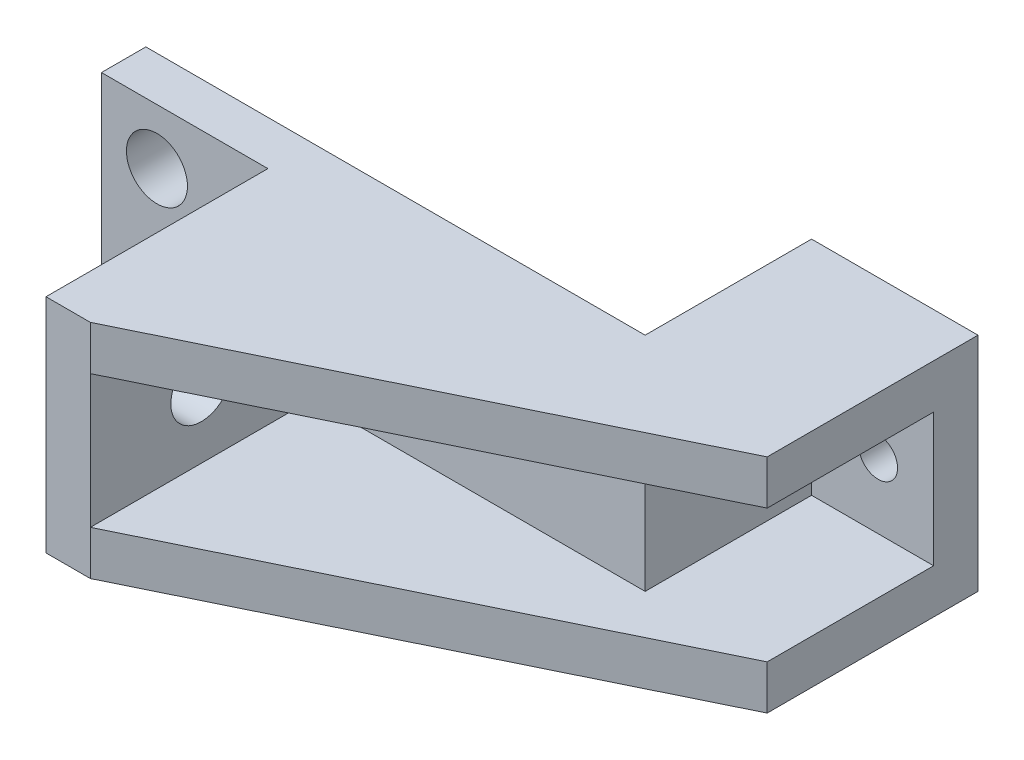
from build123d import *
from build123d.topology import SkipClean

# Parameters (mm, degrees)
SKETCH_1_W          = 60
SKETCH_1_H          = 20
SKETCH_1_R          = 2.75
SKETCH_1_R_2        = 1.75
EXTRUDE_1_DEPTH     = 4
SKETCH_2_W          = 4
SKETCH_2_H          = 20
EXTRUDE_2_DEPTH     = 24
EXTRUDE_3_DEPTH     = 4
EXTRUDE_4_DEPTH     = 4
EXTRUDE_START       = 15
SKETCH_5_W          = 45
SKETCH_5_H          = 20
SKETCH_5_R          = 1.75
EXTRUDE_5_DEPTH     = 15
SKETCH_6_W          = 40
SKETCH_6_H          = 12
CUT_EXTRUDE_1_DEPTH = 15
SKETCH_7_R          = 2.75
CUT_EXTRUDE_2_DEPTH = 15
CUT_EXTRUDE_3_REACH = 76.303
SKETCH_8_W          = 30
SKETCH_8_H          = 20
SKETCH_10_W         = 26
SKETCH_10_H         = 12
EXTRUDE_6_DEPTH     = 4
SKETCH_11_W         = 15
SKETCH_11_H         = 12
EXTRUDE_7_DEPTH     = 4


with BuildPart() as part:
    # 草图1 → 凸台-拉伸1 (new body)
    with BuildSketch(Plane.XY):
        with Locations((30, -10)):
            Rectangle(SKETCH_1_W, SKETCH_1_H)
        with Locations((5, -5)):
            Circle(SKETCH_1_R, mode=Mode.SUBTRACT)
        with Locations((5, -15)):
            Circle(SKETCH_1_R, mode=Mode.SUBTRACT)
        with Locations((55, -10)):
            Circle(SKETCH_1_R_2, mode=Mode.SUBTRACT)
    extrude(amount=EXTRUDE_1_DEPTH)

    # 草图2 → 凸台-拉伸2 (add)
    with BuildSketch(Plane(origin=(0, 0, 0), x_dir=(-1, 0, 0), z_dir=(0, 0, -1))):
        with Locations((-17, -10)):
            Rectangle(SKETCH_2_W, SKETCH_2_H)
    extrude(amount=-EXTRUDE_2_DEPTH)

    # 草图3 → 凸台-拉伸3 (add)
    with BuildSketch(Plane.XZ.offset(20)):
        Polygon((19, 24), (60, 4), (19, 4), align=None)
    extrude(amount=-EXTRUDE_3_DEPTH)

    # 草图4 → 凸台-拉伸4 (add)
    with BuildSketch(Plane(origin=(0, 0, 0), x_dir=(1, 0, 0), z_dir=(0, 1, 0))):
        Polygon((19, -24), (60, -4), (19, -4), align=None)
    extrude(amount=-EXTRUDE_4_DEPTH)

    # 草图5 → 凸台-拉伸5 (add)
    with SkipClean():  # the faces are left unmerged after this step: merging them gives an invalid solid
        with BuildSketch(Plane(origin=(0, 0, 0), x_dir=(-1, 0, 0), z_dir=(0, 0, -1)).offset(EXTRUDE_START)):
            with Locations((-37.5, -10)):
                Rectangle(SKETCH_5_W, SKETCH_5_H)
            with Locations((-55, -10)):
                Circle(SKETCH_5_R, mode=Mode.SUBTRACT)
        extrude(amount=-EXTRUDE_5_DEPTH)

    # 草图6 → 切除-拉伸1 (cut)
    with BuildSketch(Plane.XY.offset(4)):
        with Locations((40, -10)):
            Rectangle(SKETCH_6_W, SKETCH_6_H)
    extrude(amount=-CUT_EXTRUDE_1_DEPTH, mode=Mode.SUBTRACT)

    # 草图7 → 切除-拉伸2 (cut)
    with BuildSketch(Plane(origin=(19, 0, 0), x_dir=(0, 0, -1), z_dir=(1, 0, 0))):
        with Locations(Location((-14, -10, 0), (0, 0, 90))):
            Circle(SKETCH_7_R)
    extrude(amount=-CUT_EXTRUDE_2_DEPTH, mode=Mode.SUBTRACT)

    # 切除-拉伸3: up to this face of the body (flat: up to its plane)
    cut_extrude_3_end = Plane(part.part.faces().sort_by_distance((7.970492187, -10, 0))[0])
    # 草图8 → 切除-拉伸3 (cut, up to the picked face)
    with BuildSketch(Plane(origin=(0, 0, -15), x_dir=(-1, 0, 0), z_dir=(0, 0, -1)), mode=Mode.PRIVATE) as cut_extrude_3_sk1:
        with Locations((-30, -10)):
            Rectangle(SKETCH_8_W, SKETCH_8_H)
    cut_extrude_3_tool1 = split(extrude(cut_extrude_3_sk1.sketch, amount=-CUT_EXTRUDE_3_REACH, mode=Mode.PRIVATE), bisect_by=cut_extrude_3_end, keep=Keep.BOTH, mode=Mode.PRIVATE)
    add(cut_extrude_3_tool1.solids().sort_by(Axis((30, -10, -15), (0, 0, 1)))[0], mode=Mode.SUBTRACT)

    # 草图10 → 凸台-拉伸6 (add)
    with BuildSketch(Plane.XY.offset(4)):
        with Locations((32, -10)):
            Rectangle(SKETCH_10_W, SKETCH_10_H)
    extrude(amount=-EXTRUDE_6_DEPTH)

    # 草图11 → 凸台-拉伸7 (add)
    with BuildSketch(Plane(origin=(45, 0, 0), x_dir=(0, 0, -1), z_dir=(1, 0, 0))):
        with Locations((3.5, -10)):
            Rectangle(SKETCH_11_W, SKETCH_11_H)
    extrude(amount=EXTRUDE_7_DEPTH)


solid = part.part
